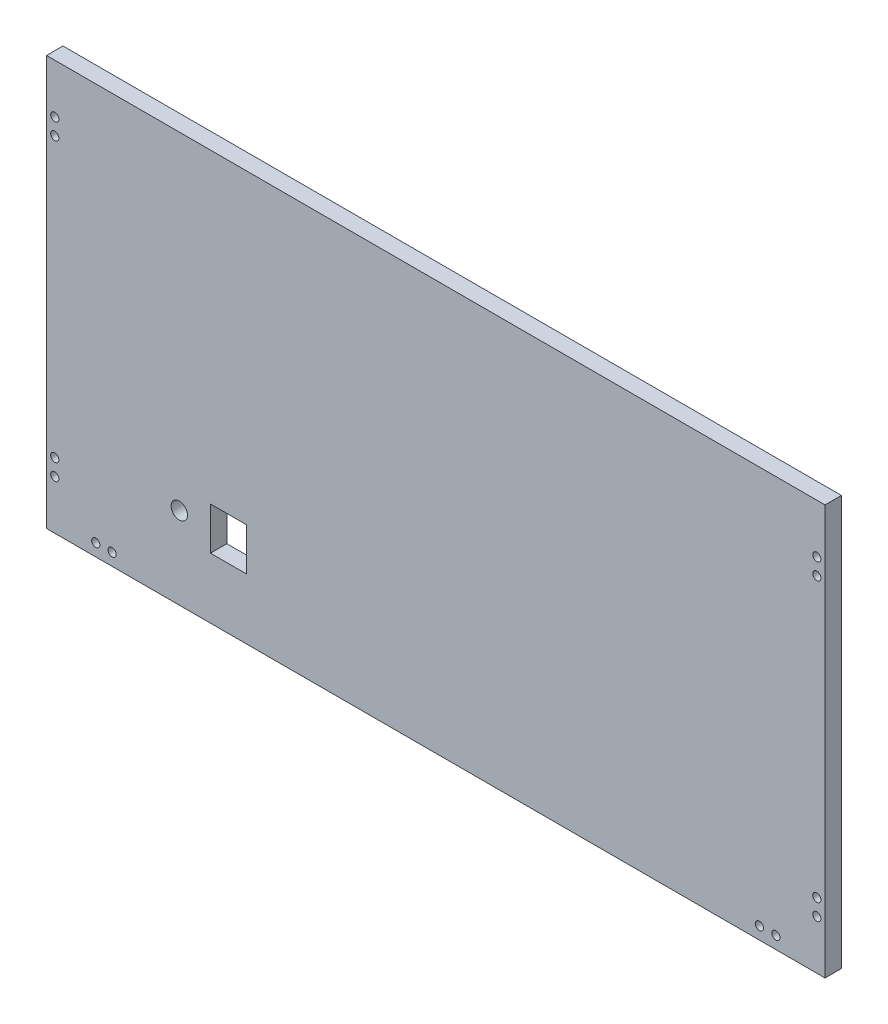
from build123d import *

# Parameters (mm, degrees)
SKETCH1_W           = 475
SKETCH1_H           = 250
BOSS_EXTRUDE1_DEPTH = 10
SKETCH2_R           = 2.5
CUT_EXTRUDE1_DEPTH  = 269.572615879
SKETCH3_R           = 2.5
CUT_EXTRUDE2_DEPTH  = 269.572615879
SKETCH4_R           = 5
SKETCH4_W           = 22
SKETCH4_H           = 26
CUT_EXTRUDE3_DEPTH  = 269.572615879


with BuildPart() as part:
    # Sketch1 → Boss-Extrude1 (new body)
    with BuildSketch(Plane.XY):
        Rectangle(SKETCH1_W, SKETCH1_H)
    extrude(amount=BOSS_EXTRUDE1_DEPTH)

    # Sketch2 → Cut-Extrude1 (cut, through all)
    with BuildSketch(Plane.XY.offset(10)):
        with Locations((-207.5, -117.5)):
            Circle(SKETCH2_R)
        with Locations((207.5, -117.5)):
            Circle(SKETCH2_R)
        with Locations((197.5, -117.5)):
            Circle(SKETCH2_R)
        with Locations((-197.5, -117.5)):
            Circle(SKETCH2_R)
    extrude(amount=-CUT_EXTRUDE1_DEPTH, mode=Mode.SUBTRACT)

    # Sketch3 → Cut-Extrude2 (cut, through all)
    with BuildSketch(Plane(origin=(0, 0, 0), x_dir=(-1, 0, 0), z_dir=(0, 0, -1))):
        with Locations((232.5, 95)):
            Circle(SKETCH3_R)
        with Locations((232.5, 85)):
            Circle(SKETCH3_R)
        with Locations((232.5, -85)):
            Circle(SKETCH3_R)
        with Locations((232.5, -95)):
            Circle(SKETCH3_R)
        with Locations((-232.5, 95)):
            Circle(SKETCH3_R)
        with Locations((-232.5, 85)):
            Circle(SKETCH3_R)
        with Locations((-232.5, -85)):
            Circle(SKETCH3_R)
        with Locations((-232.5, -95)):
            Circle(SKETCH3_R)
    extrude(amount=-CUT_EXTRUDE2_DEPTH, mode=Mode.SUBTRACT)

    # Sketch4 → Cut-Extrude3 (cut, through all)
    with BuildSketch(Plane(origin=(0, 0, 0), x_dir=(-1, 0, 0), z_dir=(0, 0, -1))):
        with Locations((156.5, -75)):
            Circle(SKETCH4_R)
        with Locations((126.5, -75)):
            Rectangle(SKETCH4_W, SKETCH4_H)
    extrude(amount=-CUT_EXTRUDE3_DEPTH, mode=Mode.SUBTRACT)


solid = part.part
